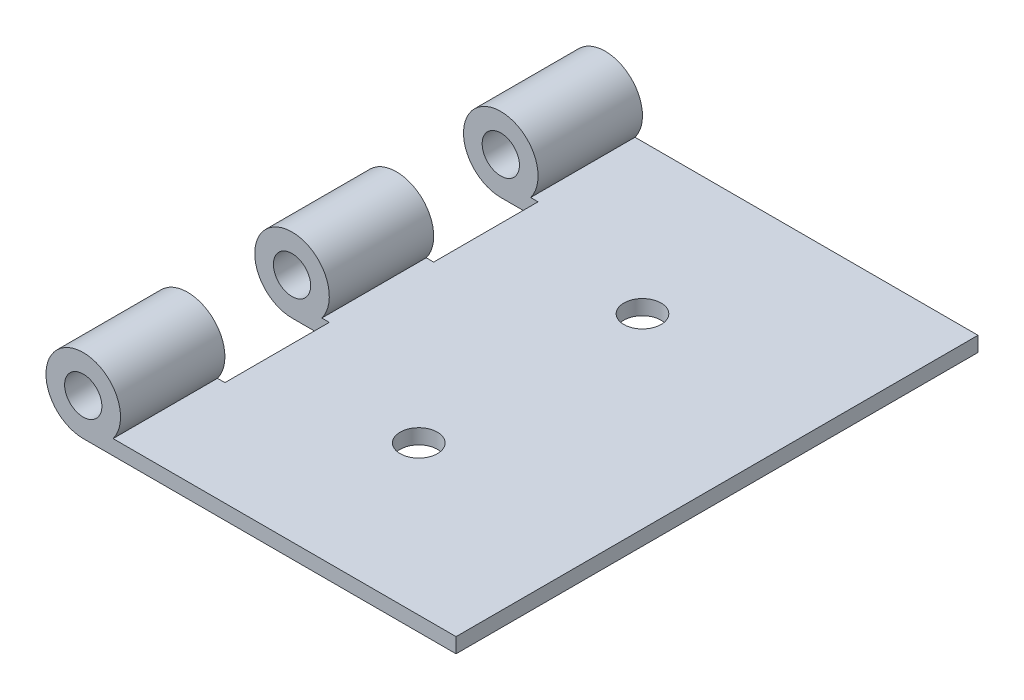
from build123d import *

# Parameters (mm, degrees)
SKETCH1_W               = 50
SKETCH1_H               = 70
BOSS_EXTRUDE1_DEPTH     = 2
SKETCH2_R               = 5
SKETCH2_R_2             = 2.5
BOSS_EXTRUDE2_DEPTH     = 70
SKETCH3_R               = 2.5
CUT_EXTRUDE1_DEPTH      = 47.786750261
CUT_EXTRUDE2_DEPTH      = 47.786750261
CUT_EXTRUDE2_DEPTH_BACK = 47.786750261
SKETCH4_W               = 10
SKETCH4_H               = 14


with BuildPart() as part:
    # Sketch1 → Boss-Extrude1 (new body)
    with BuildSketch(Plane(origin=(0, 0, 0), x_dir=(1, 0, 0), z_dir=(0, 1, 0))):
        Rectangle(SKETCH1_W, SKETCH1_H)
    extrude(amount=BOSS_EXTRUDE1_DEPTH)

    # Sketch2 → Boss-Extrude2 (add)
    with BuildSketch(Plane.XY.offset(35)):
        with Locations((-25, 5)):
            Circle(SKETCH2_R)
        with Locations((-25, 5)):
            Circle(SKETCH2_R_2, mode=Mode.SUBTRACT)
    extrude(amount=-BOSS_EXTRUDE2_DEPTH)

    # Sketch3 → Cut-Extrude1 (cut, through all)
    with BuildSketch(Plane(origin=(0, 2, 0), x_dir=(1, 0, 0), z_dir=(0, 1, 0))):
        with Locations(Location((0, 15, 0), (0, 0, 270))):
            Circle(SKETCH3_R)
        with Locations(Location((0, -15, 0), (0, 0, 270))):
            Circle(SKETCH3_R)
    extrude(amount=-CUT_EXTRUDE1_DEPTH, mode=Mode.SUBTRACT)

    # Sketch4 → Cut-Extrude2 (cut, two sides: drawn at the far end of the back side and taken through both)
    with BuildSketch(Plane(origin=(0, 2, 0), x_dir=(1, 0, 0), z_dir=(0, 1, 0)).offset(-CUT_EXTRUDE2_DEPTH_BACK)):
        with Locations((-25, -14)):
            Rectangle(SKETCH4_W, SKETCH4_H)
        with Locations((-25, 14)):
            Rectangle(SKETCH4_W, SKETCH4_H)
    extrude(amount=CUT_EXTRUDE2_DEPTH + CUT_EXTRUDE2_DEPTH_BACK, mode=Mode.SUBTRACT)


solid = part.part
